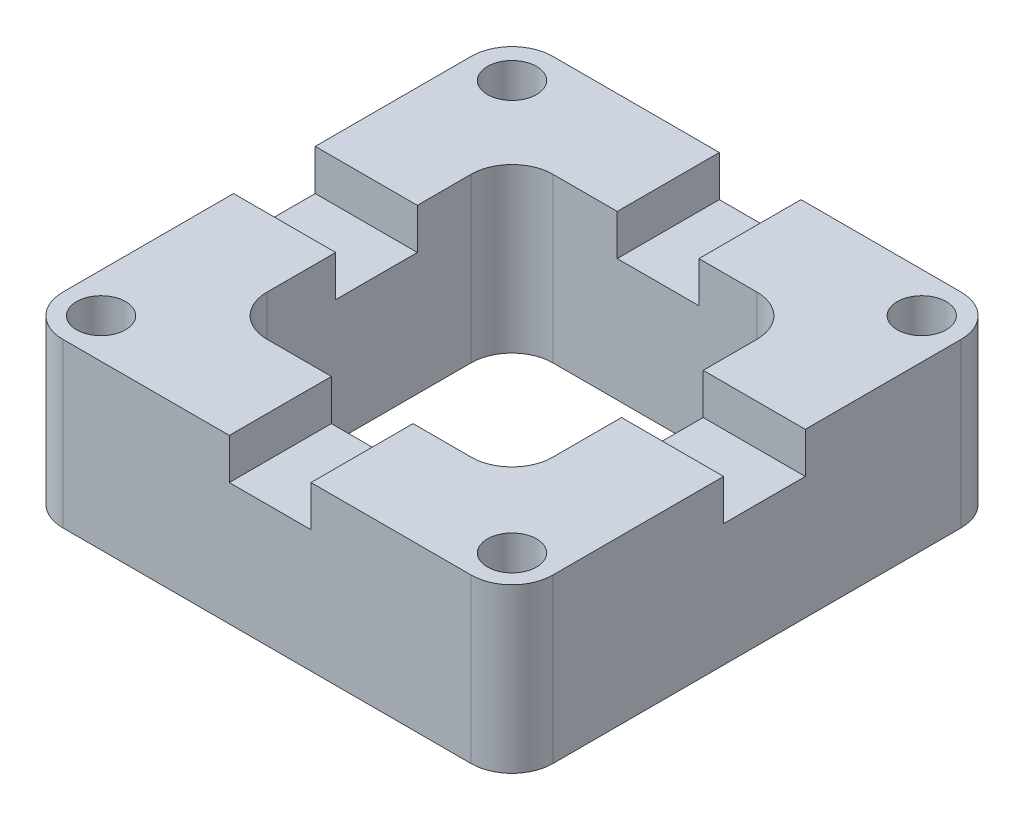
from build123d import *

# Parameters (mm, degrees)
SKETCH1_R           = 6
SKETCH1_W           = 25
SKETCH1_H           = 20
SKETCH1_W_2         = 20
SKETCH1_H_2         = 25
BOSS_EXTRUDE1_DEPTH = 30
SKETCH2_R           = 6
BOSS_EXTRUDE2_DEPTH = 10


with BuildPart() as part:
    # Sketch1 → Boss-Extrude1 (new body)
    # profile 1 of 8: a face of its own
    with BuildSketch(Plane(origin=(0, 0, 0), x_dir=(1, 0, 0), z_dir=(0, 1, 0))):
        with BuildLine():
            Line((-9.676519666, -60), (-9.676519666, -35))
            Line((-9.676519666, -35), (-25, -35))
            ThreePointArc((-25, -35), (-32.071067812, -32.071067812), (-35, -25))
            Line((-35, -25), (-35, -7.678426698))
            Line((-35, -7.678426698), (-60, -7.678426698))
            Line((-60, -7.678426698), (-60, -50))
            ThreePointArc((-60, -50), (-57.071067812, -57.071067812), (-50, -60))
            Line((-50, -60), (-9.676519666, -60))
        make_face()
        with Locations(Location((-50.316110583, -50.316110583, 0), (0, 0, 270))):
            Circle(SKETCH1_R, mode=Mode.SUBTRACT)
    # profile 2 of 8: a face of its own
    with BuildSketch(Plane(origin=(0, 0, 0), x_dir=(1, 0, 0), z_dir=(0, 1, 0))):
        with BuildLine():
            Line((-60, 12.321573302), (-35, 12.321573302))
            Line((-35, 12.321573302), (-35, 25))
            ThreePointArc((-35, 25), (-32.071067812, 32.071067812), (-25, 35))
            Line((-25, 35), (-9.676519666, 35))
            Line((-9.676519666, 35), (-9.676519666, 60))
            Line((-9.676519666, 60), (-50, 60))
            ThreePointArc((-50, 60), (-57.071067812, 57.071067812), (-60, 50))
            Line((-60, 50), (-60, 12.321573302))
        make_face()
        with Locations(Location((-49.882833986, 49.882833986, 0), (0, 0, 270))):
            Circle(SKETCH1_R, mode=Mode.SUBTRACT)
    # profile 3 of 8: a face of its own
    with BuildSketch(Plane(origin=(0, 0, 0), x_dir=(1, 0, 0), z_dir=(0, 1, 0))):
        with BuildLine():
            Line((35, 25), (35, 12.321573302))
            Line((35, 12.321573302), (60, 12.321573302))
            Line((60, 12.321573302), (60, 50))
            ThreePointArc((60, 50), (57.071067812, 57.071067812), (50, 60))
            Line((50, 60), (10.323480334, 60))
            Line((10.323480334, 60), (10.323480334, 35))
            Line((10.323480334, 35), (25, 35))
            ThreePointArc((25, 35), (32.071067812, 32.071067812), (35, 25))
        make_face()
        with Locations(Location((50.17168505, 50.17168505, 0), (0, 0, 270))):
            Circle(SKETCH1_R, mode=Mode.SUBTRACT)
    # profile 4 of 8: a face of its own
    with BuildSketch(Plane(origin=(0, 0, 0), x_dir=(1, 0, 0), z_dir=(0, 1, 0))):
        with BuildLine():
            Line((25, -35), (10.323480334, -35))
            Line((10.323480334, -35), (10.323480334, -60))
            Line((10.323480334, -60), (50, -60))
            ThreePointArc((50, -60), (57.071067812, -57.071067812), (60, -50))
            Line((60, -50), (60, -7.678426698))
            Line((60, -7.678426698), (35, -7.678426698))
            Line((35, -7.678426698), (35, -25))
            ThreePointArc((35, -25), (32.071067812, -32.071067812), (25, -35))
        make_face()
        with Locations(Location((50.316110583, -50.316110583, 0), (0, 0, 270))):
            Circle(SKETCH1_R, mode=Mode.SUBTRACT)
    # profile 5 of 8: a face of its own
    with BuildSketch(Plane(origin=(0, 0, 0), x_dir=(1, 0, 0), z_dir=(0, 1, 0))):
        with Locations((-47.5, 2.321573302)):
            Rectangle(SKETCH1_W, SKETCH1_H)
    # profile 6 of 8: a face of its own
    with BuildSketch(Plane(origin=(0, 0, 0), x_dir=(1, 0, 0), z_dir=(0, 1, 0))):
        with Locations((47.5, 2.321573302)):
            Rectangle(SKETCH1_W, SKETCH1_H)
    # profile 7 of 8: a face of its own
    with BuildSketch(Plane(origin=(0, 0, 0), x_dir=(1, 0, 0), z_dir=(0, 1, 0))):
        with Locations((0.323480334, 47.5)):
            Rectangle(SKETCH1_W_2, SKETCH1_H_2)
    # profile 8 of 8: a face of its own
    with BuildSketch(Plane(origin=(0, 0, 0), x_dir=(1, 0, 0), z_dir=(0, 1, 0))):
        with Locations((0.323480334, -47.5)):
            Rectangle(SKETCH1_W_2, SKETCH1_H_2)
    extrude(amount=BOSS_EXTRUDE1_DEPTH)

    # Sketch2 → Boss-Extrude2 (add)
    # profile 1 of 4: a face of its own
    with BuildSketch(Plane(origin=(0, 30, 0), x_dir=(1, 0, 0), z_dir=(0, 1, 0))):
        with BuildLine():
            Line((-9.228273843, 35), (-9.228273843, 60))
            Line((-9.228273843, 60), (-50, 60))
            ThreePointArc((-50, 60), (-57.071067812, 57.071067812), (-60, 50))
            Line((-60, 50), (-60, 11.816725799))
            Line((-60, 11.816725799), (-35, 11.816725799))
            Line((-35, 11.816725799), (-35, 25))
            ThreePointArc((-35, 25), (-32.071067812, 32.071067812), (-25, 35))
            Line((-25, 35), (-9.228273843, 35))
        make_face()
        with Locations(Location((-49.882833986, 49.882833986, 0), (0, 0, 270))):
            Circle(SKETCH2_R, mode=Mode.SUBTRACT)
    # profile 2 of 4: a face of its own
    with BuildSketch(Plane(origin=(0, 30, 0), x_dir=(1, 0, 0), z_dir=(0, 1, 0))):
        with BuildLine():
            Line((50, 60), (10.771726157, 60))
            Line((10.771726157, 60), (10.771726157, 35))
            Line((10.771726157, 35), (25, 35))
            ThreePointArc((25, 35), (32.071067812, 32.071067812), (35, 25))
            Line((35, 25), (35, 11.816725799))
            Line((35, 11.816725799), (60, 11.816725799))
            Line((60, 11.816725799), (60, 50))
            ThreePointArc((60, 50), (57.071067812, 57.071067812), (50, 60))
        make_face()
        with Locations(Location((50.17168505, 50.17168505, 0), (0, 0, 270))):
            Circle(SKETCH2_R, mode=Mode.SUBTRACT)
    # profile 3 of 4: a face of its own
    with BuildSketch(Plane(origin=(0, 30, 0), x_dir=(1, 0, 0), z_dir=(0, 1, 0))):
        with BuildLine():
            Line((60, -50), (60, -8.183274201))
            Line((60, -8.183274201), (35, -8.183274201))
            Line((35, -8.183274201), (35, -25))
            ThreePointArc((35, -25), (32.071067812, -32.071067812), (25, -35))
            Line((25, -35), (10.771726157, -35))
            Line((10.771726157, -35), (10.771726157, -60))
            Line((10.771726157, -60), (50, -60))
            ThreePointArc((50, -60), (57.071067812, -57.071067812), (60, -50))
        make_face()
        with Locations(Location((50.316110583, -50.316110583, 0), (0, 0, 270))):
            Circle(SKETCH2_R, mode=Mode.SUBTRACT)
    # profile 4 of 4: a face of its own
    with BuildSketch(Plane(origin=(0, 30, 0), x_dir=(1, 0, 0), z_dir=(0, 1, 0))):
        with BuildLine():
            Line((-35, -8.183274201), (-60, -8.183274201))
            Line((-60, -8.183274201), (-60, -50))
            ThreePointArc((-60, -50), (-57.071067812, -57.071067812), (-50, -60))
            Line((-50, -60), (-9.228273843, -60))
            Line((-9.228273843, -60), (-9.228273843, -35))
            Line((-9.228273843, -35), (-25, -35))
            ThreePointArc((-25, -35), (-32.071067812, -32.071067812), (-35, -25))
            Line((-35, -25), (-35, -8.183274201))
        make_face()
        with Locations(Location((-50.316110583, -50.316110583, 0), (0, 0, 270))):
            Circle(SKETCH2_R, mode=Mode.SUBTRACT)
    extrude(amount=BOSS_EXTRUDE2_DEPTH)


solid = part.part
